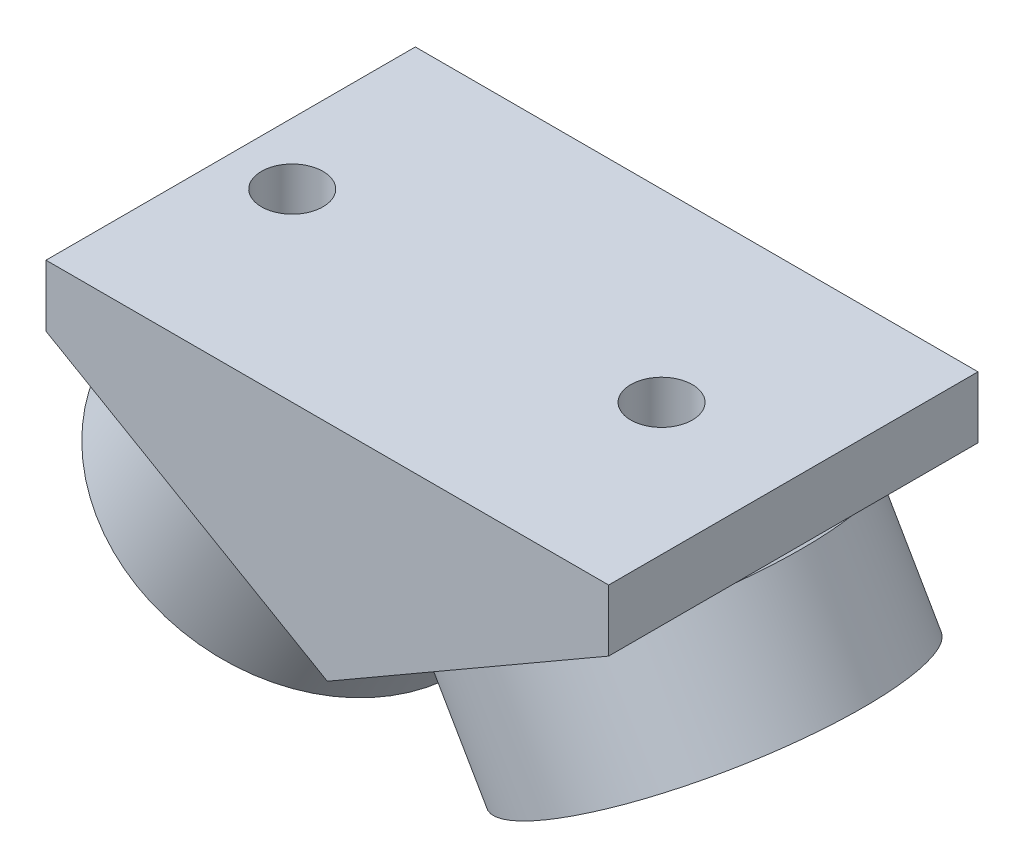
from build123d import *

# Parameters (mm, degrees)
BOSS_EXTRUDE1_DEPTH = 38.1
SKETCH4_R           = 17.78
SKETCH4_R_2         = 13.97
BOSS_EXTRUDE3_DEPTH = 12.7
SKETCH5_R           = 3.175
CUT_EXTRUDE2_DEPTH  = 12.7


with BuildPart() as part:
    # Sketch1 → Boss-Extrude1 (new body)
    with BuildSketch(Plane.XY):
        Polygon((-29.021915902, 16.755810958), (-29.021915902, 23.105810958), (29.021915902, 23.105810958), (29.021915902, 16.755810958), (0, 0), align=None)
    extrude(amount=BOSS_EXTRUDE1_DEPTH)

    # Sketch4 → Boss-Extrude3 (add)
    with BuildSketch(Plane(origin=(0, 0, 0), x_dir=(0.8660254037844379, -0.5000000000000012, 0), z_dir=(-0.5000000000000012, -0.8660254037844379, 0))):
        with Locations(Location((-16.755810958, 19.05, 0), (0, 0, 160.458003801))):
            Circle(SKETCH4_R)
        with Locations((-16.755810958, 19.05)):
            Circle(SKETCH4_R_2, mode=Mode.SUBTRACT)
    boss_extrude3 = extrude(amount=BOSS_EXTRUDE3_DEPTH)

    # Mirror2: Boss-Extrude3 across plane
    add(boss_extrude3.mirror(Plane.ZY))

    # Sketch5 → Cut-Extrude2 (cut)
    with BuildSketch(Plane(origin=(0, 23.105810958, 0), x_dir=(1, 0, 0), z_dir=(0, 1, 0))):
        with Locations(Location((-22.671915902, -19.05, 0), (0, 0, 270))):
            Circle(SKETCH5_R)
        with Locations(Location((15.428084098, -19.05, 0), (0, 0, 270))):
            Circle(SKETCH5_R)
    extrude(amount=-CUT_EXTRUDE2_DEPTH, mode=Mode.SUBTRACT)


solid = part.part
